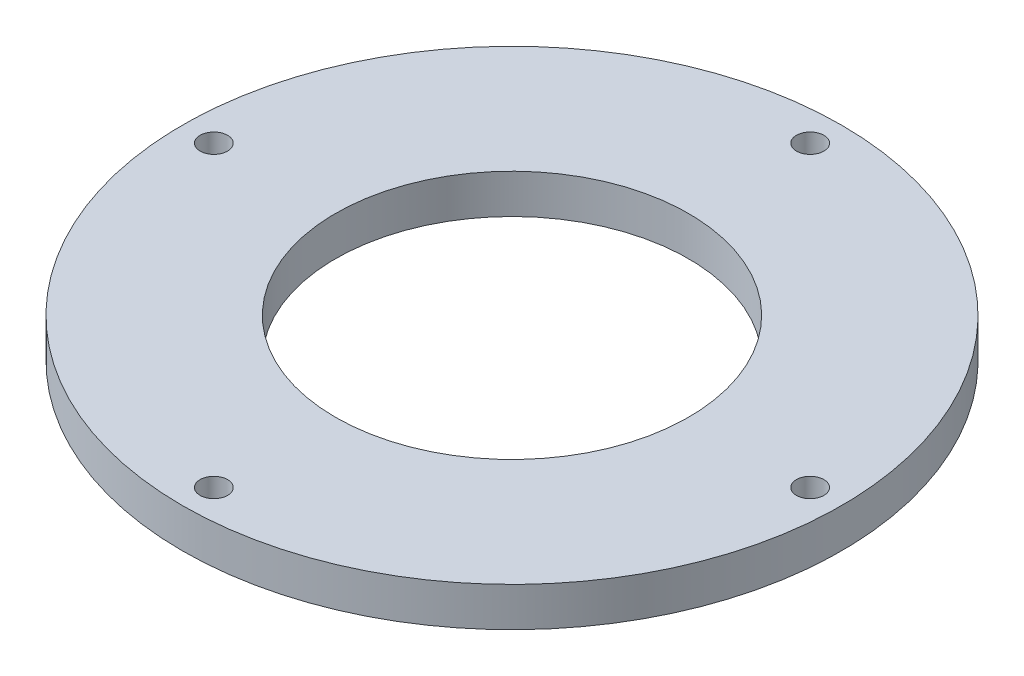
from build123d import *

# Parameters (mm, degrees)
SKETCH1_R            = 84
SKETCH1_R_2          = 45
BOSS_EXTRUDE1_DEPTH  = 10
M6_CLEARANCE_HOLE1_D = 7


with BuildPart() as part:
    # Sketch1 → Boss-Extrude1 (new body)
    with BuildSketch(Plane(origin=(0, 0, 0), x_dir=(1, 0, 0), z_dir=(0, 1, 0))):
        with Locations(Location((0, 0, 0), (0, 0, 270))):
            Circle(SKETCH1_R)
        with Locations(Location((0, 0, 0), (0, 0, 270))):
            Circle(SKETCH1_R_2, mode=Mode.SUBTRACT)
    extrude(amount=BOSS_EXTRUDE1_DEPTH)

    # M6 Clearance Hole1 (through all)
    with Locations(Plane(origin=(-76, 10, 0), x_dir=(0, 0, 1), z_dir=(0, 1, 0))):
        with Locations((0, 0), (-76, 76), (0, 152), (76, 76)):
            Hole(M6_CLEARANCE_HOLE1_D / 2)


solid = part.part
